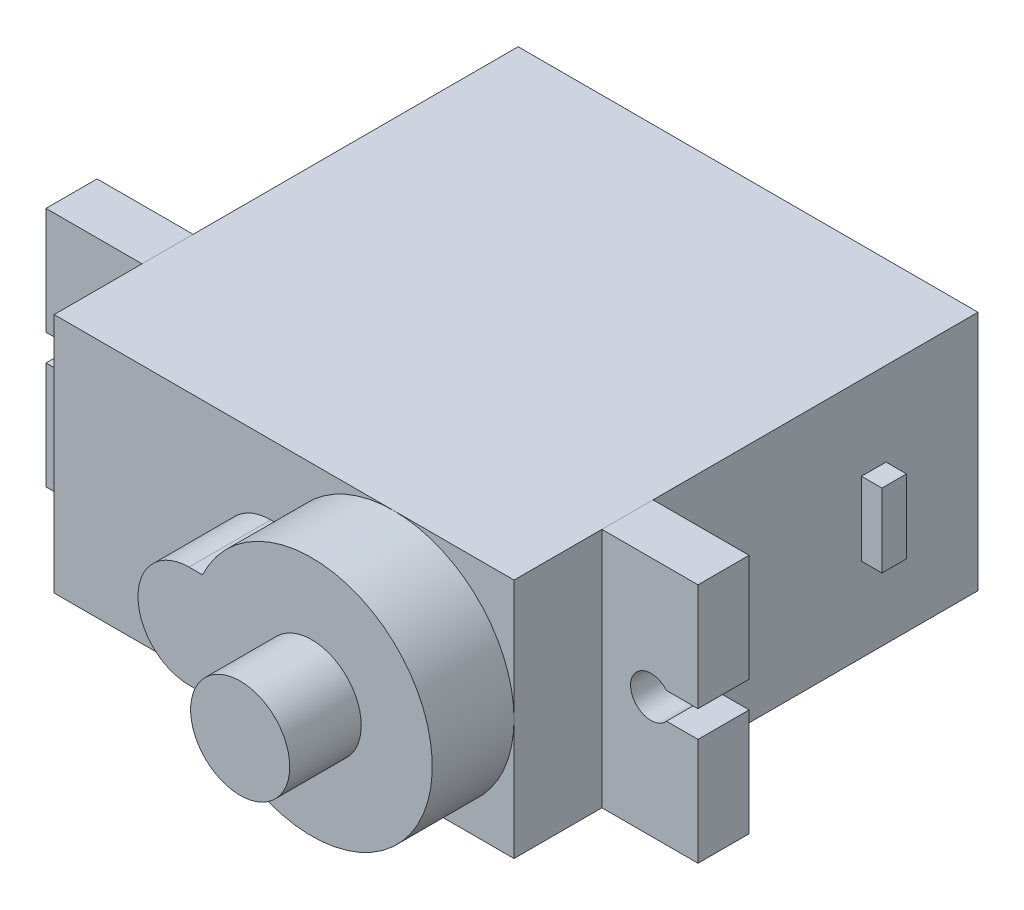
from build123d import *

# Parameters (mm, degrees)
CROQUIS1_W                = 22.5
CROQUIS1_H                = 11.8
SALIENTE_EXTRUIR2_DEPTH   = 15.9
SALIENTE_EXTRUIR3_DEPTH   = 2.5
SALIENTE_EXTRUIR3_2_DEPTH = 2.5
CROQUIS3_W                = 22.5
CROQUIS3_H                = 11.8
SALIENTE_EXTRUIR4_DEPTH   = 22.7
SALIENTE_EXTRUIR5_DEPTH   = 4
CROQUIS5_R                = 2.425
SALIENTE_EXTRUIR6_DEPTH   = 3.5
CROQUIS7_W                = 1.2
CROQUIS7_H                = 3.6
SALIENTE_EXTRUIR7_DEPTH   = 1


with BuildPart() as part:
    # Croquis1 → Saliente-Extruir2 (new body)
    with BuildSketch(Plane.XY):
        Rectangle(CROQUIS1_W, CROQUIS1_H)
    extrude(amount=SALIENTE_EXTRUIR2_DEPTH)

    # Croquis3 → Saliente-Extruir4 (add)
    with BuildSketch(Plane(origin=(0, 0, 0), x_dir=(-1, 0, 0), z_dir=(0, 0, -1))):
        Rectangle(CROQUIS3_W, CROQUIS3_H)
    extrude(amount=-SALIENTE_EXTRUIR4_DEPTH)

    # Croquis4 → Saliente-Extruir5 (add)
    with BuildSketch(Plane.XY.offset(22.7)):
        with BuildLine():
            Line((-0.65, 2.5), (0.005844314, 2.5))
            ThreePointArc((0.005844314, 2.5), (11.25, 0), (0.005844314, -2.5))
            Line((0.005844314, -2.5), (-0.65, -2.5))
            ThreePointArc((-0.65, -2.5), (-3.15, 0), (-0.65, 2.5))
        make_face()
    extrude(amount=SALIENTE_EXTRUIR5_DEPTH)

    # Croquis5 → Saliente-Extruir6 (add)
    with BuildSketch(Plane.XY.offset(26.7)):
        with Locations((5.35, 0)):
            Circle(CROQUIS5_R)
    extrude(amount=SALIENTE_EXTRUIR6_DEPTH)

    # Croquis7 → Saliente-Extruir7 (add)
    with BuildSketch(Plane(origin=(11.25, 0, 0), x_dir=(0, 0, -1), z_dir=(1, 0, 0))):
        with Locations((-5.1, 0)):
            Rectangle(CROQUIS7_W, CROQUIS7_H)
    extrude(amount=SALIENTE_EXTRUIR7_DEPTH)


with BuildPart() as body_2:
    # Croquis2 → Saliente-Extruir3 (new body)
    with BuildSketch(Plane.XY.offset(15.9)):
        with BuildLine():
            Line((-11.25, 5.9), (-15.95, 5.9))
            Line((-15.95, 5.9), (-15.95, 0.65))
            Line((-15.95, 0.65), (-14.409934208, 0.65))
            ThreePointArc((-14.409934208, 0.65), (-12.65, 0), (-14.409934208, -0.65))
            Line((-14.409934208, -0.65), (-15.95, -0.65))
            Line((-15.95, -0.65), (-15.95, -5.9))
            Line((-15.95, -5.9), (-11.25, -5.9))
            Line((-11.25, -5.9), (-11.25, 5.9))
        make_face()
    extrude(amount=SALIENTE_EXTRUIR3_DEPTH)


with BuildPart() as body_3:
    # Croquis2 → Saliente-Extruir3 2 (new body)
    with BuildSketch(Plane.XY.offset(15.9)):
        with BuildLine():
            Line((15.95, -0.65), (15.95, -5.9))
            Line((15.95, -5.9), (11.25, -5.9))
            Line((11.25, -5.9), (11.25, 5.9))
            Line((11.25, 5.9), (15.95, 5.9))
            Line((15.95, 5.9), (15.95, 0.65))
            Line((15.95, 0.65), (14.409934208, 0.65))
            ThreePointArc((14.409934208, 0.65), (12.65, 0), (14.409934208, -0.65))
            Line((14.409934208, -0.65), (15.95, -0.65))
        make_face()
    extrude(amount=SALIENTE_EXTRUIR3_2_DEPTH)


solid = Compound([part.part, body_2.part, body_3.part])
